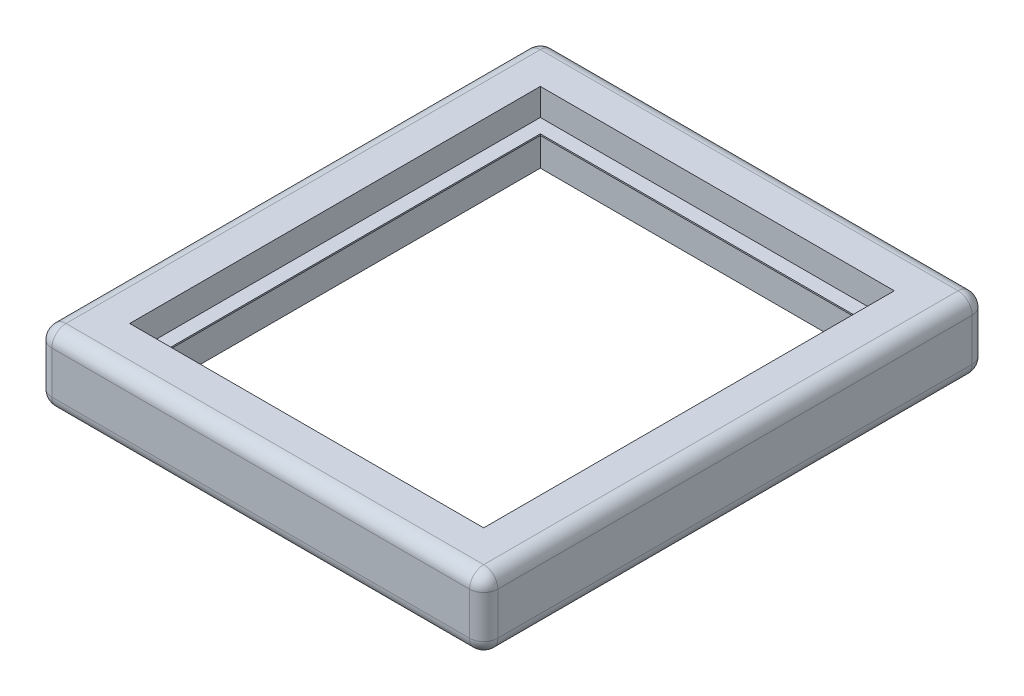
from build123d import *

# Parameters (mm, degrees)
BOSS_EXTRUDE1_DEPTH      = 50.8
BOSS_EXTRUDE1_DEPTH_BACK = 76.2
SKETCH1_W                = 800.1
SKETCH1_H                = 901.7
SKETCH1_W_2              = 635
SKETCH1_H_2              = 736.6
SKETCH1_3_W              = 635
SKETCH1_3_H              = 736.6
SKETCH1_3_W_2            = 584.2
SKETCH1_3_H_2            = 685.8
BOSS_EXTRUDE2_DEPTH      = 2.54
FILLET1_R                = 25.4


with BuildPart() as part:
    # Sketch1 → Boss-Extrude1 (new, two sides: drawn at the far end of the back side and taken through both)
    with BuildSketch(Plane(origin=(0, 0, 0), x_dir=(1, 0, 0), z_dir=(0, 1, 0)).offset(-BOSS_EXTRUDE1_DEPTH_BACK)):
        Rectangle(SKETCH1_W, SKETCH1_H)
        Rectangle(SKETCH1_W_2, SKETCH1_H_2, mode=Mode.SUBTRACT)
    extrude(amount=BOSS_EXTRUDE1_DEPTH + BOSS_EXTRUDE1_DEPTH_BACK)

    # Sketch1<3> → Boss-Extrude2 (add)
    with BuildSketch(Plane(origin=(0, 0, 0), x_dir=(1, 0, 0), z_dir=(0, 1, 0))):
        Rectangle(SKETCH1_3_W, SKETCH1_3_H)
        Rectangle(SKETCH1_3_W_2, SKETCH1_3_H_2, mode=Mode.SUBTRACT)
    extrude(amount=BOSS_EXTRUDE2_DEPTH)

    # Fillet1
    fillet1_edges = [part.edges().sort_by_distance(p)[0] for p in [
        (400.05, -76.2, 0),
        (400.05, -12.7, 450.85),
        (400.05, 50.8, 0),
        (400.05, -12.7, -450.85),
        (-400.05, -12.7, -450.85),
        (-400.05, -12.7, 450.85),
        (-400.05, -76.2, 0),
        (0, -76.2, -450.85),
        (0, -76.2, 450.85),
        (0, 50.8, 450.85),
        (0, 50.8, -450.85),
        (-400.05, 50.8, 0),
    ]]
    fillet(fillet1_edges, radius=FILLET1_R)


solid = part.part
